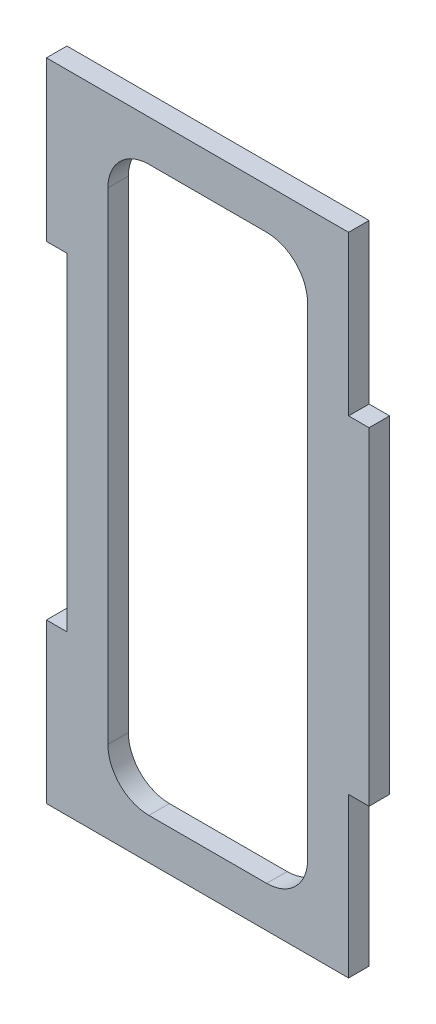
from build123d import *

# Parameters (mm, degrees)
SKETCH1_W           = 100
SKETCH1_H           = 200.1518
BOSS_EXTRUDE1_DEPTH = 6.35
SKETCH2_W           = 6.35
SKETCH2_H           = 50.8
SKETCH2_H_2         = 49.2759
CUT_EXTRUDE1_DEPTH  = 6.35
SKETCH3_W           = 61.9
SKETCH3_H           = 174.7518
CUT_EXTRUDE2_DEPTH  = 6.35
FILLET1_R           = 12.7


with BuildPart() as part:
    # Sketch1 → Boss-Extrude1 (new body)
    with BuildSketch(Plane.XY):
        with Locations((0, -50.0759)):
            Rectangle(SKETCH1_W, SKETCH1_H)
    extrude(amount=BOSS_EXTRUDE1_DEPTH)

    # Sketch2 → Cut-Extrude1 (cut)
    with BuildSketch(Plane.XY.offset(6.35)):
        with Locations((-46.825, -24.6759)):
            Rectangle(SKETCH2_W, SKETCH2_H)
        with Locations((-46.825, -75.4759)):
            Rectangle(SKETCH2_W, SKETCH2_H)
        with Locations((46.825, 25.36205)):
            Rectangle(SKETCH2_W, SKETCH2_H_2)
        with Locations((46.825, -125.51385)):
            Rectangle(SKETCH2_W, SKETCH2_H_2)
    extrude(amount=-CUT_EXTRUDE1_DEPTH, mode=Mode.SUBTRACT)

    # Sketch3 → Cut-Extrude2 (cut)
    with BuildSketch(Plane.XY.offset(6.35)):
        with Locations((0, -50.0759)):
            Rectangle(SKETCH3_W, SKETCH3_H)
    extrude(amount=-CUT_EXTRUDE2_DEPTH, mode=Mode.SUBTRACT)

    # Fillet1
    fillet1_edges = [part.edges().sort_by_distance(p)[0] for p in [
        (-30.95, -137.4518, 3.175),
        (-30.95, 37.3, 3.175),
        (30.95, 37.3, 3.175),
        (30.95, -137.4518, 3.175),
    ]]
    fillet(fillet1_edges, radius=FILLET1_R)


solid = part.part
